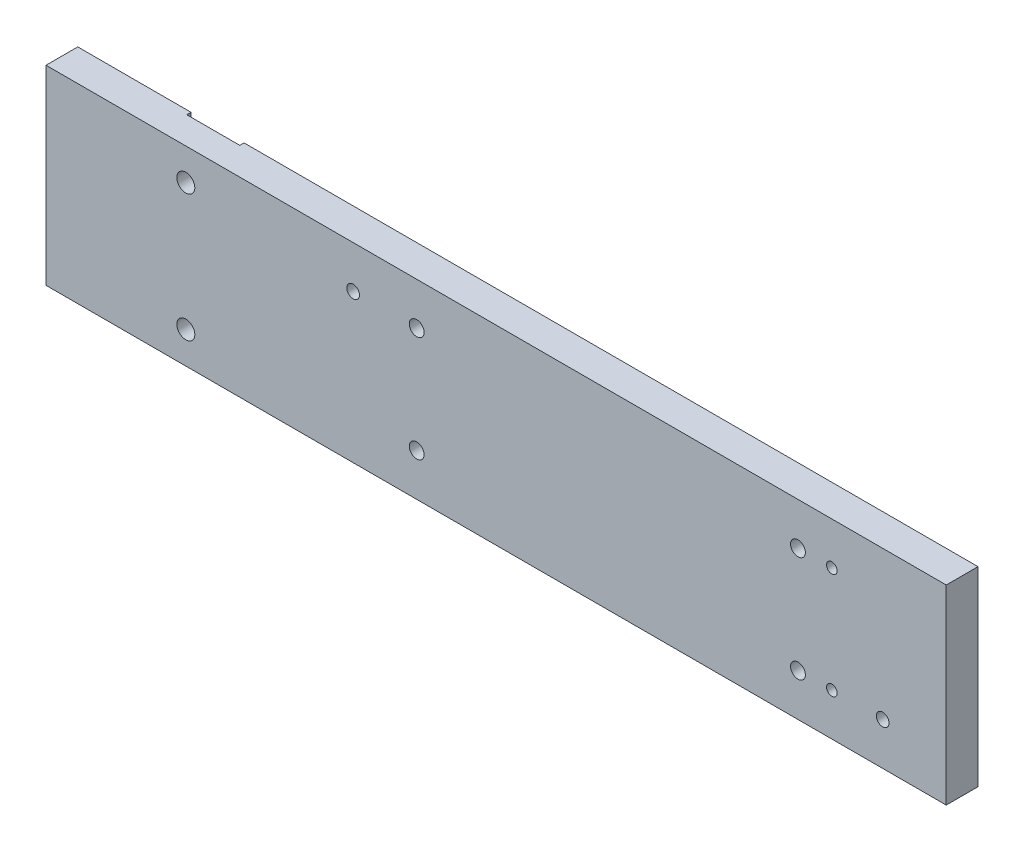
from build123d import *

# Parameters (mm, degrees)
SKETCH_1_W                     = 425
SKETCH_1_H                     = 90
EXTRUDE_1_DEPTH                = 15
SKETCH_2_W                     = 25
SKETCH_2_H                     = 2
CUT_EXTRUDE_1_DEPTH            = 435.683793119
HOLE_WIZARD_M10_1_D            = 8.5
HOLE_WIZARD_M10_1_DEPTH        = 24.5
HOLE_WIZARD_M10_1_TIP          = 2.553657631
HOLE_WIZARD_M6_1_D             = 5
HOLE_WIZARD_M6_1_DEPTH         = 15
HOLE_WIZARD_M6_1_TIP           = 1.502151548
HOLE_WIZARD_M5_1_D             = 4.2
HOLE_WIZARD_M5_1_DEPTH         = 12.4
HOLE_WIZARD_M5_1_TIP           = 1.2618073
HOLE_WIZARD_M6_2_D             = 5
HOLE_WIZARD_M6_2_DEPTH         = 15
HOLE_WIZARD_M6_2_TIP           = 1.502151548
SKETCH_11_R                    = 3
CUT_EXTRUDE_2_DEPTH            = 435.683793119
HOLE_WIZARD_M6_1_2_D           = 7
HOLE_WIZARD_M6_1_2_CBORE_D     = 11
HOLE_WIZARD_M6_1_2_CBORE_DEPTH = 6


with BuildPart() as part:
    # 草图1 → 凸台-拉伸1 (new body)
    with BuildSketch(Plane.XY):
        with Locations((212.5, 45)):
            Rectangle(SKETCH_1_W, SKETCH_1_H)
    extrude(amount=EXTRUDE_1_DEPTH)

    # 草图2 → 切除-拉伸1 (cut, through all)
    with BuildSketch(Plane(origin=(0, 90, 0), x_dir=(1, 0, 0), z_dir=(0, 1, 0))):
        with Locations((66, -1)):
            Rectangle(SKETCH_2_W, SKETCH_2_H)
    extrude(amount=-CUT_EXTRUDE_1_DEPTH, mode=Mode.SUBTRACT)

    # M10 螺纹孔1
    with Locations(Plane(origin=(0, 0, 2), x_dir=(-1, 0, 0), z_dir=(0, 0, -1))):
        with Locations((-66, 75), (-66, 15)):
            Hole(HOLE_WIZARD_M10_1_D / 2, depth=HOLE_WIZARD_M10_1_DEPTH)
            with Locations((0, 0, -(HOLE_WIZARD_M10_1_DEPTH + HOLE_WIZARD_M10_1_TIP / 2))):  # 118° drill point
                Cone(0, HOLE_WIZARD_M10_1_D / 2, HOLE_WIZARD_M10_1_TIP, mode=Mode.SUBTRACT)

    # Hole Wizard M6 _1
    with Locations(Plane.ZY):
        with Locations((7.5, 68), (7.5, 22)):
            Hole(HOLE_WIZARD_M6_1_D / 2, depth=HOLE_WIZARD_M6_1_DEPTH)
            with Locations((0, 0, -(HOLE_WIZARD_M6_1_DEPTH + HOLE_WIZARD_M6_1_TIP / 2))):  # 118° drill point
                Cone(0, HOLE_WIZARD_M6_1_D / 2, HOLE_WIZARD_M6_1_TIP, mode=Mode.SUBTRACT)

    # M5 螺纹孔1
    with Locations(Plane.XZ):
        with Locations((9, 8), (44, 8)):
            Hole(HOLE_WIZARD_M5_1_D / 2, depth=HOLE_WIZARD_M5_1_DEPTH)
            with Locations((0, 0, -(HOLE_WIZARD_M5_1_DEPTH + HOLE_WIZARD_M5_1_TIP / 2))):  # 118° drill point
                Cone(0, HOLE_WIZARD_M5_1_D / 2, HOLE_WIZARD_M5_1_TIP, mode=Mode.SUBTRACT)

    # M6 螺纹孔2
    with Locations(Plane(origin=(0, 0, 0), x_dir=(-1, 0, 0), z_dir=(0, 0, -1))):
        with Locations((-371, 70), (-371, 20)):
            Hole(HOLE_WIZARD_M6_2_D / 2, depth=HOLE_WIZARD_M6_2_DEPTH)
            with Locations((0, 0, -(HOLE_WIZARD_M6_2_DEPTH + HOLE_WIZARD_M6_2_TIP / 2))):  # 118° drill point
                Cone(0, HOLE_WIZARD_M6_2_D / 2, HOLE_WIZARD_M6_2_TIP, mode=Mode.SUBTRACT)

    # 草图11 → 切除-拉伸2 (cut, through all)
    with BuildSketch(Plane(origin=(0, 0, 0), x_dir=(-1, 0, 0), z_dir=(0, 0, -1))):
        with Locations((-145, 70)):
            Circle(SKETCH_11_R)
        with Locations((-395, 20)):
            Circle(SKETCH_11_R)
    extrude(amount=-CUT_EXTRUDE_2_DEPTH, mode=Mode.SUBTRACT)

    # Hole Wizard M6 _1 2 (through all)
    with Locations(Plane(origin=(0, 0, 0), x_dir=(-1, 0, 0), z_dir=(0, 0, -1))):
        with Locations((-175, 20), (-355, 20), (-175, 70), (-355, 70)):
            CounterBoreHole(HOLE_WIZARD_M6_1_2_D / 2, HOLE_WIZARD_M6_1_2_CBORE_D / 2, HOLE_WIZARD_M6_1_2_CBORE_DEPTH)


solid = part.part
